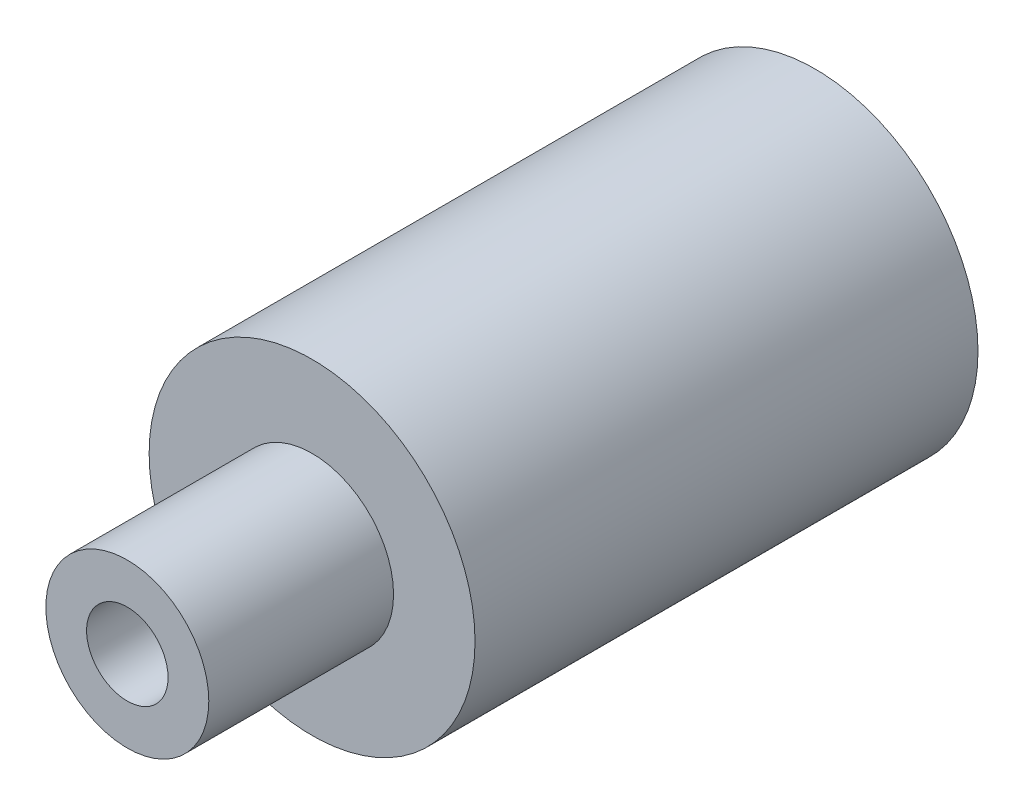
from build123d import *

# Parameters (mm, degrees)
SKETCH2_R          = 3.175
CUT_EXTRUDE1_DEPTH = 25
SKETCH3_R          = 6.35
CUT_EXTRUDE2_DEPTH = 25


with BuildPart() as part:
    # Sketch1 → Revolve1 (revolve)
    with BuildSketch(Plane(origin=(0, 0, 0), x_dir=(0, 0, -1), z_dir=(1, 0, 0)), mode=Mode.PRIVATE) as revolve1_sk:
        Polygon((14.4, 6.35), (14.4, 12.7), (53.6, 12.7), (53.6, 0), (0, 0), (0, 6.35), align=None)
    revolve(revolve1_sk.sketch.rotate(Axis((0, 0, 0), (0, 0, -1)), 90), axis=Axis((0, 0, 0), (0, 0, -1)))

    # Sketch2 → Cut-Extrude1 (cut)
    with BuildSketch(Plane.XY):
        Circle(SKETCH2_R)
    extrude(amount=-CUT_EXTRUDE1_DEPTH, mode=Mode.SUBTRACT)

    # Sketch3 → Cut-Extrude2 (cut)
    with BuildSketch(Plane(origin=(0, 0, -53.6), x_dir=(-1, 0, 0), z_dir=(0, 0, -1))):
        with Locations(Location((0, 0, 0), (0, 0, 180))):
            Circle(SKETCH3_R)
    extrude(amount=-CUT_EXTRUDE2_DEPTH, mode=Mode.SUBTRACT)


solid = part.part
